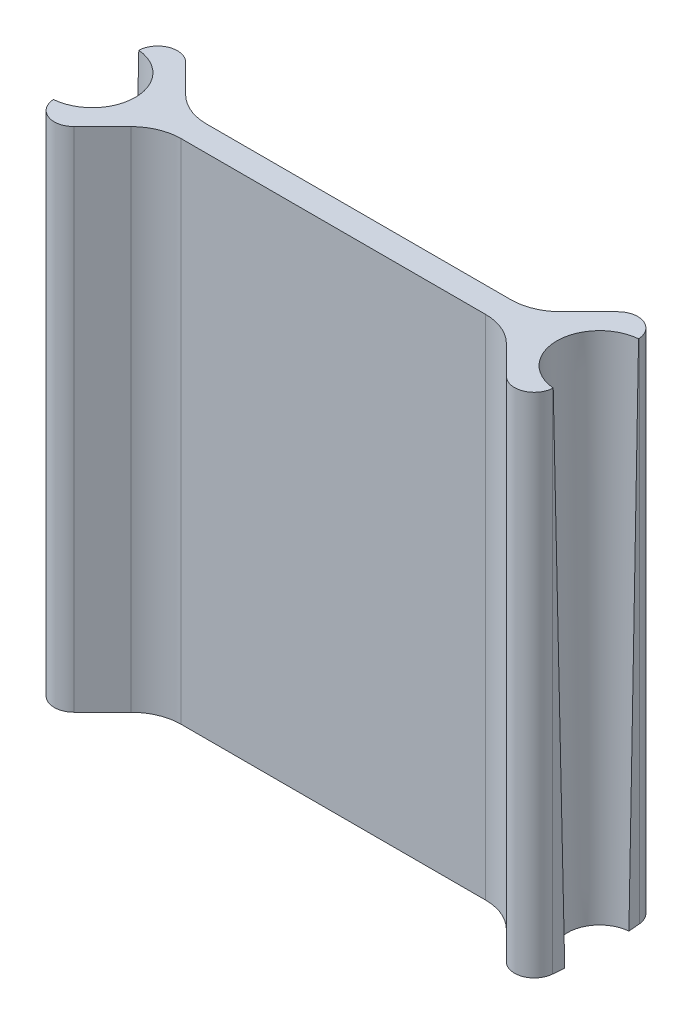
from build123d import *

# Parameters (mm, degrees)
BOSS_EXTRUDE2_DEPTH          = 10
SKETCH5_R                    = 0.635
CUT_EXTRUDE1_DEPTH           = 10
CUT_EXTRUDE1_DRAFT           = 1.2
CUT_EXTRUDE1_PROFILE_2_DEPTH = 10
CUT_EXTRUDE1_PROFILE_2_DRAFT = 1.2


with BuildPart() as part:
    # Sketch2 → Boss-Extrude2 (new body)
    with BuildSketch(Plane(origin=(0, 0, 0), x_dir=(1, 0, 0), z_dir=(0, 1, 0))):
        with BuildLine():
            Line((0.055343897, 0.632583633), (0.075113859, 0.858555332))
            ThreePointArc((0.075113859, 0.858555332), (0.329887136, 1.190582332), (0.738477631, 1.1))
            Line((0.738477631, 1.1), (1.297487373, 0.540990258))
            ThreePointArc((1.297487373, 0.540990258), (1.619802906, 0.325625904), (2, 0.25))
            Line((2, 0.25), (8, 0.25))
            ThreePointArc((8, 0.25), (8.380197094, 0.325625904), (8.702512627, 0.540990258))
            Line((8.702512627, 0.540990258), (9.261522369, 1.1))
            ThreePointArc((9.261522369, 1.1), (9.670112864, 1.190582332), (9.924886141, 0.858555332))
            Line((9.924886141, 0.858555332), (9.944656103, 0.632583633))
            Line((9.944656103, 0.632583633), (9.944656103, -0.632583633))
            Line((9.944656103, -0.632583633), (9.924886141, -0.858555332))
            ThreePointArc((9.924886141, -0.858555332), (9.670112864, -1.190582332), (9.261522369, -1.1))
            Line((9.261522369, -1.1), (8.702512627, -0.540990258))
            ThreePointArc((8.702512627, -0.540990258), (8.380197094, -0.325625904), (8, -0.25))
            Line((8, -0.25), (2, -0.25))
            ThreePointArc((2, -0.25), (1.619802906, -0.325625904), (1.297487373, -0.540990258))
            Line((1.297487373, -0.540990258), (0.738477631, -1.1))
            ThreePointArc((0.738477631, -1.1), (0.329887136, -1.190582332), (0.075113859, -0.858555332))
            Line((0.075113859, -0.858555332), (0.055343897, -0.632583633))
            Line((0.055343897, -0.632583633), (0.055343897, 0.632583633))
        make_face()
    extrude(amount=BOSS_EXTRUDE2_DEPTH)


with BuildPart() as cut_extrude1_tool:
    # Sketch5 → Cut-Extrude1 (with draft: the straight prism first)
    with BuildSketch(Plane.XZ):
        Circle(SKETCH5_R)
    extrude(amount=-CUT_EXTRUDE1_DEPTH)
    # Cut-Extrude1: the draft: its side faces are tilted about the plane it starts from
    cut_extrude1_sides = [cut_extrude1_tool.faces().sort_by_distance(p)[0] for p in [
        (-0.635, 5, 0),
    ]]
    draft(cut_extrude1_sides, Plane.XZ, CUT_EXTRUDE1_DRAFT)


with BuildPart() as part_1:
    add(part.part)

    # Cut-Extrude1: cut by cut_extrude1_tool
    add(cut_extrude1_tool.part, mode=Mode.SUBTRACT)


with BuildPart() as cut_extrude1_profile_2_tool:
    # Sketch5 → Cut-Extrude1 profile 2 (with draft: the straight prism first)
    with BuildSketch(Plane.XZ):
        with Locations((10, 0)):
            Circle(SKETCH5_R)
    extrude(amount=-CUT_EXTRUDE1_PROFILE_2_DEPTH)
    # Cut-Extrude1 profile 2: the draft: its side faces are tilted about the plane it starts from
    cut_extrude1_profile_2_sides = [cut_extrude1_profile_2_tool.faces().sort_by_distance(p)[0] for p in [
        (9.365, 5, 0),
    ]]
    draft(cut_extrude1_profile_2_sides, Plane.XZ, CUT_EXTRUDE1_PROFILE_2_DRAFT)


with BuildPart() as part_2:
    add(part_1.part)

    # Cut-Extrude1 profile 2: cut by cut_extrude1_profile_2_tool
    add(cut_extrude1_profile_2_tool.part, mode=Mode.SUBTRACT)


solid = part_2.part
